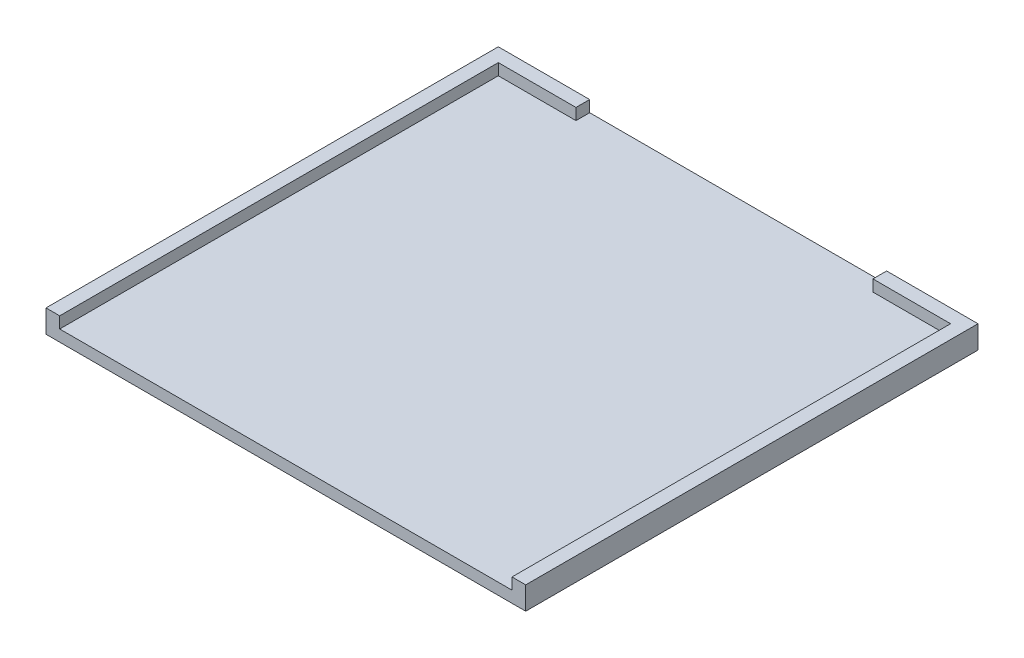
from build123d import *

# Parameters (mm, degrees)
BOSS_EXTRUDE1_DEPTH = 0.5
SKETCH2_W           = 21
SKETCH2_H           = 19.8
BOSS_EXTRUDE2_DEPTH = 0.5
SKETCH3_W           = 13
SKETCH3_H           = 0.5
CUT_EXTRUDE1_DEPTH  = 25.442919676


with BuildPart() as part:
    # Sketch1 → Boss-Extrude1 (new body)
    with BuildSketch(Plane(origin=(0, 0, 0), x_dir=(1, 0, 0), z_dir=(0, 1, 0))):
        Polygon((-15.118410045, 7.342838361), (-15.118410045, -12.457161639), (-14.518410045, -12.457161639), (-14.518410045, 6.742838361), (5.281589955, 6.742838361), (5.281589955, -12.457161639), (5.881589955, -12.457161639), (5.881589955, 7.342838361), align=None)
    extrude(amount=BOSS_EXTRUDE1_DEPTH)

    # Sketch2 → Boss-Extrude2 (add)
    with BuildSketch(Plane.XZ):
        with Locations((-4.618410045, 2.557161639)):
            Rectangle(SKETCH2_W, SKETCH2_H)
    extrude(amount=BOSS_EXTRUDE2_DEPTH)

    # Sketch3 → Cut-Extrude1 (cut, through all)
    with BuildSketch(Plane.XY.offset(-6.742838361)):
        with Locations((-4.618410045, 0.25)):
            Rectangle(SKETCH3_W, SKETCH3_H)
    extrude(amount=-CUT_EXTRUDE1_DEPTH, mode=Mode.SUBTRACT)


solid = part.part
